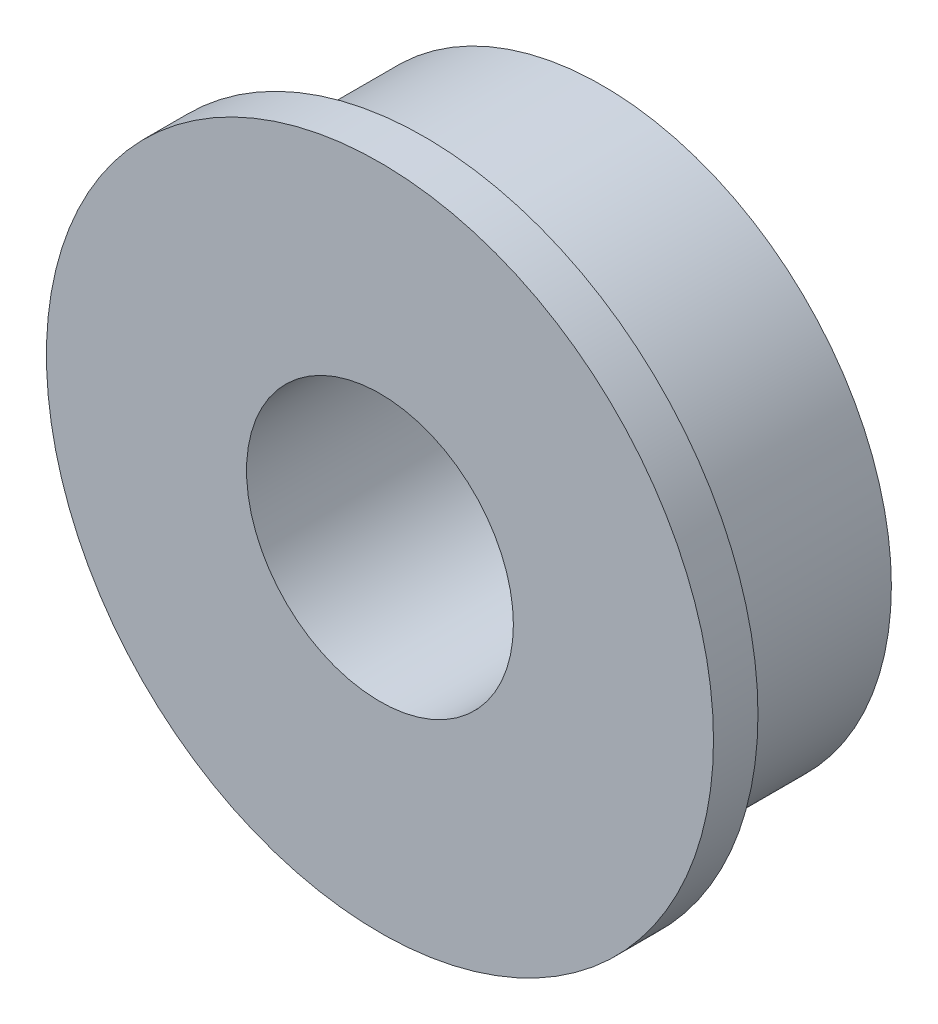
from build123d import *


with BuildPart() as part:
    # Sketch1 → 686ZZ (revolve)
    with BuildSketch(Plane(origin=(0, 0, 0), x_dir=(0, 0, -1), z_dir=(1, 0, 0)), mode=Mode.PRIVATE) as f_686zz_sk:
        Polygon((0, 3), (0, 7.5), (1, 7.5), (1, 6.5), (5, 6.5), (5, 3), align=None)
    revolve(f_686zz_sk.sketch.rotate(Axis((0, 0, 0), (0, 0, -1)), 90), axis=Axis((0, 0, 0), (0, 0, -1)))


solid = part.part
